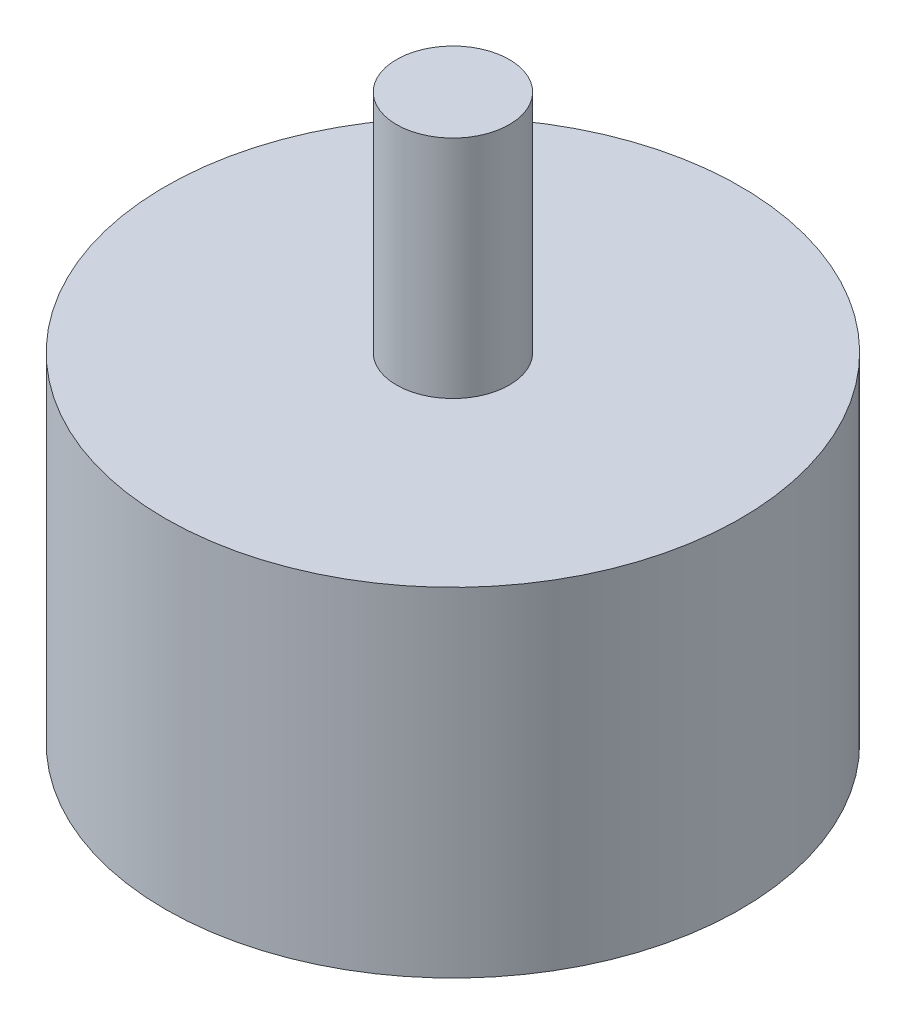
from build123d import *

# Parameters (mm, degrees)
CROQUIS1_R              = 12.75
SALIENTE_EXTRUIR1_DEPTH = 15
CROQUIS2_R              = 2.5
SALIENTE_EXTRUIR2_DEPTH = 10


with BuildPart() as part:
    # Croquis1 → Saliente-Extruir1 (new body)
    with BuildSketch(Plane(origin=(0, 0, 0), x_dir=(1, 0, 0), z_dir=(0, 1, 0))):
        with Locations(Location((0, 0, 0), (0, 0, 270))):
            Circle(CROQUIS1_R)
    extrude(amount=SALIENTE_EXTRUIR1_DEPTH)

    # Croquis2 → Saliente-Extruir2 (add)
    with BuildSketch(Plane(origin=(0, 15, 0), x_dir=(1, 0, 0), z_dir=(0, 1, 0))):
        with Locations(Location((0, 0, 0), (0, 0, 270))):
            Circle(CROQUIS2_R)
    extrude(amount=SALIENTE_EXTRUIR2_DEPTH)


solid = part.part
